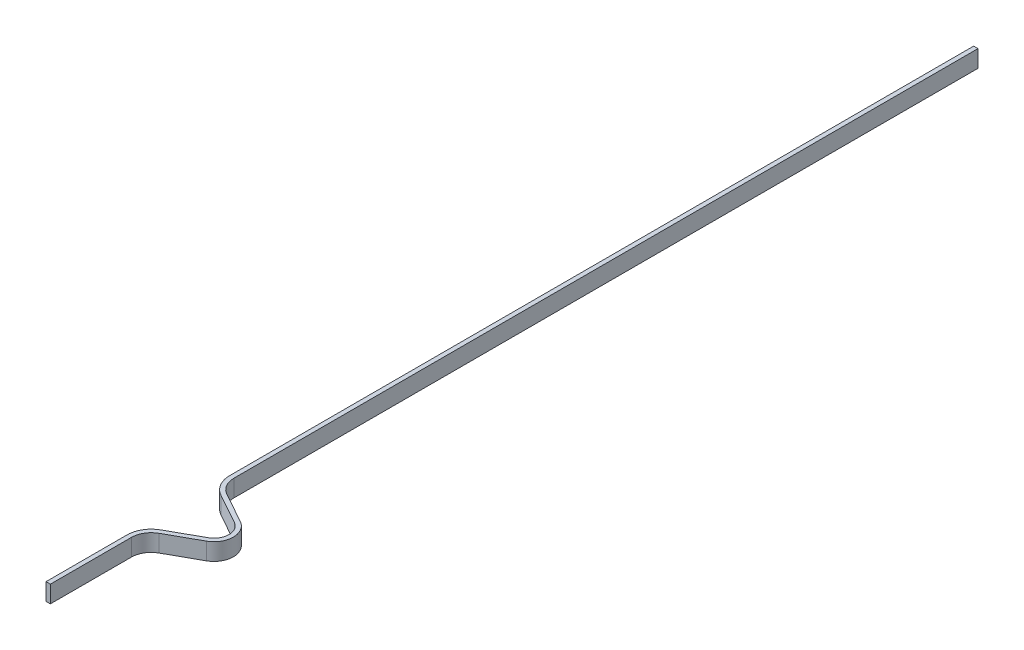
from build123d import *

# Parameters (mm, degrees)
EXTRUDE_THIN3_DEPTH = 3


with BuildPart() as part:
    # Sketch1 → Extrude-Thin3 (new, symmetric)
    with BuildSketch(Plane(origin=(-8.571526854, 0, 0.941402276), x_dir=(-1, 0, 0), z_dir=(0, -1, 0))):
        with BuildLine():
            Line((6.083742525, 254.190869482), (6.083742525, -6.564052672))
            ThreePointArc((6.083742525, -6.564052672), (5.117891111, -10.112157919), (2.486870856, -12.681136746))
            Line((2.486870856, -12.681136746), (-8.21486115, -18.634850467))
            ThreePointArc((-8.21486115, -18.634850467), (-11.701257475, -24.564052672), (-8.21486115, -30.493254878))
            Line((-8.21486115, -30.493254878), (2.486870856, -36.446968599))
            ThreePointArc((2.486870856, -36.446968599), (5.117891111, -39.015947426), (6.083742525, -42.564052672))
            Line((6.083742525, -42.564052672), (6.083742525, -70.927467156))
            Line((6.083742525, -70.927467156), (7.603742525, -70.927467156))
            Line((7.603742525, -70.927467156), (7.603742525, -42.564052672))
            ThreePointArc((7.603742525, -42.564052672), (6.428163376, -38.245501715), (3.225835865, -35.118687486))
            Line((3.225835865, -35.118687486), (-7.475896141, -29.164973765))
            ThreePointArc((-7.475896141, -29.164973765), (-10.181257475, -24.564052672), (-7.475896141, -19.96313158))
            Line((-7.475896141, -19.96313158), (3.225835865, -14.009417859))
            ThreePointArc((3.225835865, -14.009417859), (6.428163376, -10.88260363), (7.603742525, -6.564052672))
            Line((7.603742525, -6.564052672), (7.603742525, 254.190869482))
            Line((7.603742525, 254.190869482), (6.083742525, 254.190869482))
        make_face()
    extrude(amount=EXTRUDE_THIN3_DEPTH, both=True)


solid = part.part
